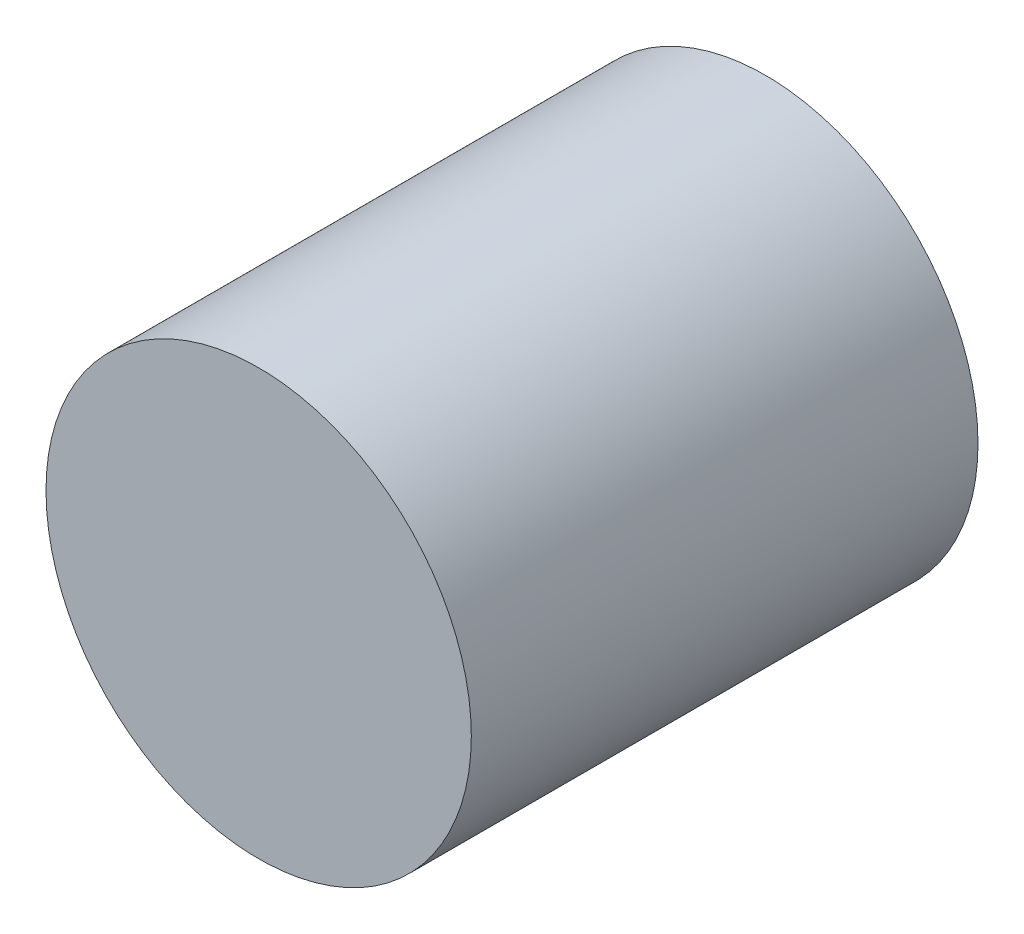
from build123d import *

# Parameters (mm, degrees)
SKETCH1_R           = 13.85
BOSS_EXTRUDE1_DEPTH = 33


with BuildPart() as part:
    # Sketch1 → Boss-Extrude1 (new body)
    with BuildSketch(Plane.XY):
        Circle(SKETCH1_R)
    extrude(amount=BOSS_EXTRUDE1_DEPTH)


solid = part.part
